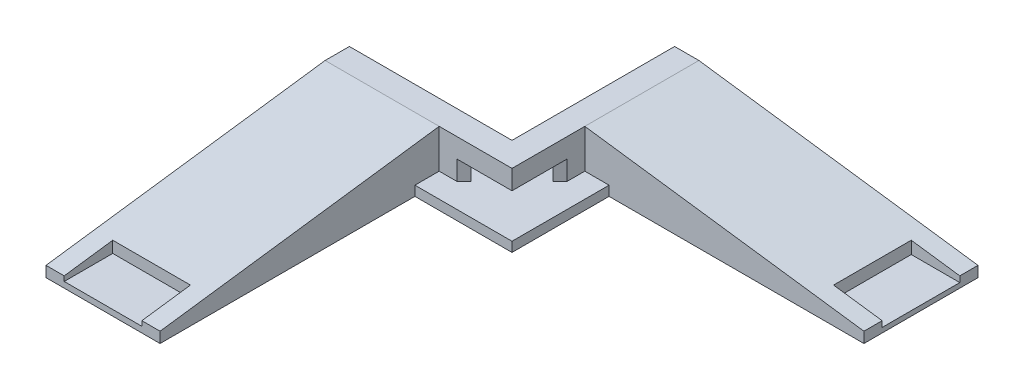
from build123d import *

# Parameters (mm, degrees)
BOSS_EXTRUDE1_DEPTH = 2
BOSS_EXTRUDE2_DEPTH = 8
SKETCH7_W           = 20
SKETCH7_H           = 16
CUT_EXTRUDE4_DEPTH  = 1
SKETCH8_W           = 23.5
SKETCH8_H           = 10
CUT_EXTRUDE5_DEPTH  = 205.156097213
SKETCH9_W           = 10
SKETCH9_H           = 23.5
CUT_EXTRUDE6_DEPTH  = 197.517261647
SKETCH16_W          = 16
SKETCH16_H          = 4
CUT_EXTRUDE7_DEPTH  = 10
SKETCH17_W          = 12
SKETCH17_H          = 4
CUT_EXTRUDE8_DEPTH  = 115.37923137
SKETCH18_W          = 14.430433489
SKETCH18_H          = 4
CUT_EXTRUDE9_DEPTH  = 9


with BuildPart() as part:
    # Sketch1 → Boss-Extrude1 (new body)
    with BuildSketch(Plane(origin=(0, 0, 0), x_dir=(1, 0, 0), z_dir=(0, 1, 0))):
        Polygon((23, -85.533895191), (23, -95.533895191), (23, -158.033895191), (46.5, -158.033895191), (46.5, -95.533895191), (66.5, -95.533895191), (66.5, -75.533895191), (129, -75.533895191), (129, -52.033895191), (66.5, -52.033895191), (56.5, -52.033895191), (56.5, -85.533895191), align=None)
    extrude(amount=BOSS_EXTRUDE1_DEPTH)

    # Sketch2 → Boss-Extrude2 (add)
    with BuildSketch(Plane(origin=(0, 2, 0), x_dir=(1, 0, 0), z_dir=(0, 1, 0))):
        Polygon((56.5, -52.033895191), (61.5, -52.033895191), (61.5, -90.533895191), (23, -90.533895191), (23, -85.533895191), (56.5, -85.533895191), align=None)
    extrude(amount=BOSS_EXTRUDE2_DEPTH)

    # Sketch7 → Cut-Extrude4 (cut)
    with BuildSketch(Plane(origin=(0, 2, 0), x_dir=(1, 0, 0), z_dir=(0, 1, 0))):
        with Locations((119, -63.783895191)):
            Rectangle(SKETCH7_W, SKETCH7_H)
    extrude(amount=-CUT_EXTRUDE4_DEPTH, mode=Mode.SUBTRACT)

    # Sketch8 → Cut-Extrude5 (cut, through all)
    with BuildSketch(Plane(origin=(0, 2, 0), x_dir=(1, 0, 0), z_dir=(0, 1, 0))):
        with Locations((34.75, -153.033895191)):
            Rectangle(SKETCH8_W, SKETCH8_H)
    extrude(amount=-CUT_EXTRUDE5_DEPTH, mode=Mode.SUBTRACT)

    # Sketch9 → Cut-Extrude6 (cut, through all)
    with BuildSketch(Plane(origin=(0, 2, 0), x_dir=(1, 0, 0), z_dir=(0, 1, 0))):
        with Locations((124, -63.783895191)):
            Rectangle(SKETCH9_W, SKETCH9_H)
    extrude(amount=-CUT_EXTRUDE6_DEPTH, mode=Mode.SUBTRACT)

    # Sketch11 → Loft3 section 0
    with BuildSketch(Plane.XY.offset(90.533895191)):
        with BuildLine():
            Line((46.5, 2), (46.5, 10))
            Line((46.5, 10), (23, 10))
            Line((23, 10), (23, 2))
            Line((23, 2), (46.5, 2))
        make_face()
    # Sketch13 → Loft3 section 1
    with BuildSketch(Plane.XY.offset(148.033895191)):
        with BuildLine():
            Line((23, 2), (23, 2.2))
            Line((23, 2.2), (46.5, 2.2))
            Line((46.5, 2.2), (46.5, 2))
            Line((46.5, 2), (23, 2))
        make_face()
    loft3 = loft()

    # Sketch16 → Cut-Extrude7 (cut)
    with BuildSketch(Plane.XY.offset(148.033895191)):
        with Locations((34.75, 3.2)):
            Rectangle(SKETCH16_W, SKETCH16_H)
    cut_extrude7 = extrude(amount=-CUT_EXTRUDE7_DEPTH, mode=Mode.SUBTRACT)

    # Mirror2: Loft3, Cut-Extrude7 across plane
    add(loft3.mirror(Plane(origin=(-14.516947595, 0, 14.516947595), x_dir=(0.7071067811865507, 0, 0.7071067811865444), z_dir=(-0.7071067811865446, 0, 0.7071067811865506))))
    add(cut_extrude7.mirror(Plane(origin=(-14.516947595, 0, 14.516947595), x_dir=(0.7071067811865507, 0, 0.7071067811865444), z_dir=(-0.7071067811865446, 0, 0.7071067811865506))), mode=Mode.SUBTRACT)

    # Sketch17 → Cut-Extrude8 (cut, through all)
    with BuildSketch(Plane(origin=(54.266947595, 0, 54.266947595), x_dir=(0.7071067811865475, 0, -0.7071067811865477), z_dir=(0.7071067811865477, 0, 0.7071067811865475))):
        with Locations((-20.530064174, 4)):
            Rectangle(SKETCH17_W, SKETCH17_H)
    extrude(amount=CUT_EXTRUDE8_DEPTH, mode=Mode.SUBTRACT)

    # Sketch18 → Cut-Extrude9 (cut, symmetric)
    with BuildSketch(Plane(origin=(-14.516947595, 0, 14.516947595), x_dir=(0.7071067811865446, 0, 0.7071067811865505), z_dir=(-0.7071067811865505, 0, 0.7071067811865446))):
        with Locations((106.719415005, 4)):
            Rectangle(SKETCH18_W, SKETCH18_H)
    extrude(amount=CUT_EXTRUDE9_DEPTH, both=True, mode=Mode.SUBTRACT)


solid = part.part
